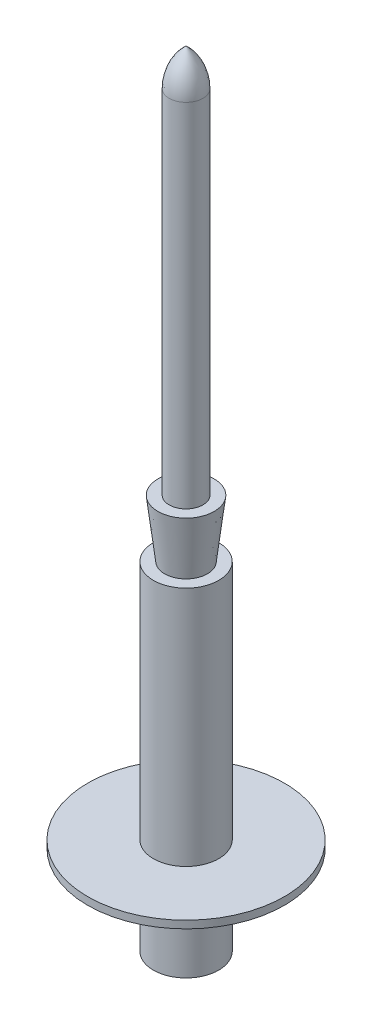
from build123d import *


with BuildPart() as part:
    # Sketch1 → Revolve1 (revolve)
    with BuildSketch(Plane.XY, mode=Mode.PRIVATE) as revolve1_sk:
        with BuildLine():
            Line((0, 0), (2.9, 0))
            Line((2.9, 0), (2.9, 7.9))
            Line((2.9, 7.9), (8.732864907, 7.9))
            Line((8.732864907, 7.9), (8.732864907, 8.57))
            Line((8.732864907, 8.57), (2.9, 8.57))
            Line((2.9, 8.57), (2.9, 29.97))
            Line((2.9, 29.97), (1.9, 29.97))
            Line((1.9, 29.97), (2.5, 35.07))
            Line((2.5, 35.07), (1.5, 35.07))
            Line((1.5, 35.07), (1.5, 66.323834281))
            ThreePointArc((1.5, 66.323834281), (1.107157772, 68.124815809), (0, 69.598607228))
            Line((0, 69.598607228), (0, 0))
        make_face()
    revolve(revolve1_sk.sketch.rotate(Axis((0, 69.598607228, 0), (0, -1, 0)), 90), axis=Axis((0, 69.598607228, 0), (0, -1, 0)))


solid = part.part
